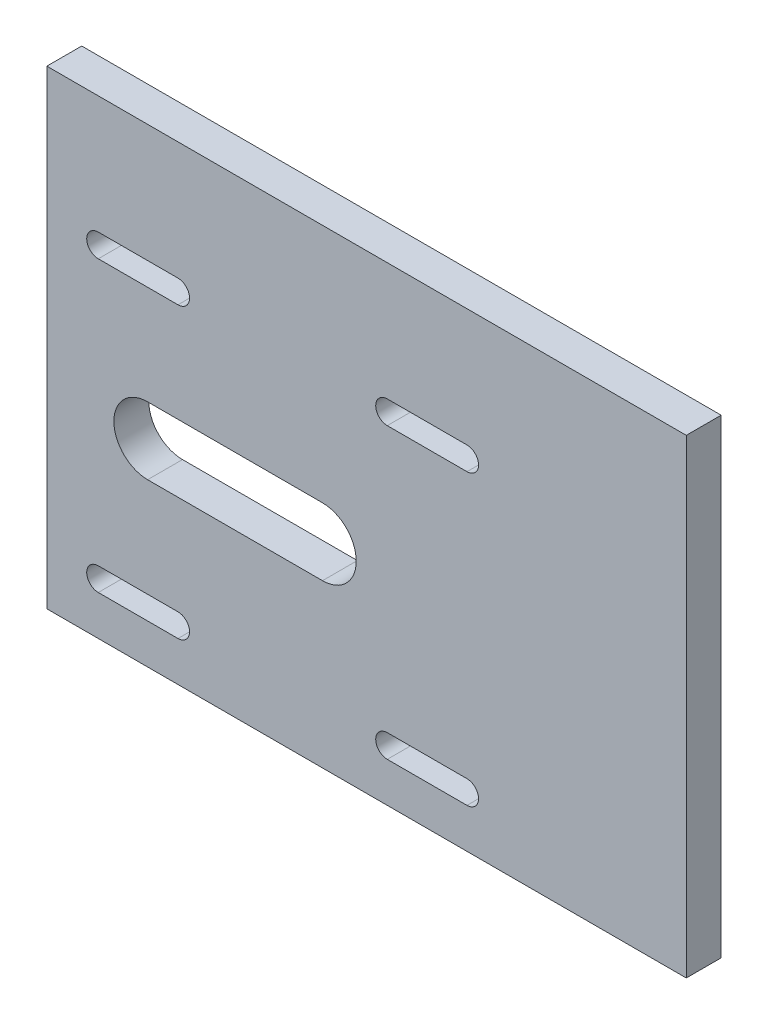
from build123d import *

# Parameters (mm, degrees)
SKETCH1_W           = 203.721686737
SKETCH1_H           = 149.733
BOSS_EXTRUDE1_DEPTH = 11.1125


with BuildPart() as part:
    # Sketch1 → Boss-Extrude1 (new body)
    with BuildSketch(Plane.XY):
        with Locations((-182.696343369, -43.420313263)):
            Rectangle(SKETCH1_W, SKETCH1_H)
        with BuildLine():
            Line((-242.774186737, -105.586813263), (-268.174186737, -105.586813263))
            ThreePointArc((-268.174186737, -105.586813263), (-271.857186737, -101.903813263), (-268.174186737, -98.220813263))
            Line((-268.174186737, -98.220813263), (-242.774186737, -98.220813263))
            ThreePointArc((-242.774186737, -98.220813263), (-239.091186737, -101.903813263), (-242.774186737, -105.586813263))
        make_face(mode=Mode.SUBTRACT)
        with BuildLine():
            Line((-242.774186737, -13.511813263), (-268.174186737, -13.511813263))
            ThreePointArc((-268.174186737, -13.511813263), (-271.857186737, -9.828813263), (-268.174186737, -6.145813263))
            Line((-268.174186737, -6.145813263), (-242.774186737, -6.145813263))
            ThreePointArc((-242.774186737, -6.145813263), (-239.091186737, -9.828813263), (-242.774186737, -13.511813263))
        make_face(mode=Mode.SUBTRACT)
        with BuildLine():
            Line((-150.699186737, -13.511813263), (-176.099186737, -13.511813263))
            ThreePointArc((-176.099186737, -13.511813263), (-179.782186737, -9.828813263), (-176.099186737, -6.145813263))
            Line((-176.099186737, -6.145813263), (-150.699186737, -6.145813263))
            ThreePointArc((-150.699186737, -6.145813263), (-147.016186737, -9.828813263), (-150.699186737, -13.511813263))
        make_face(mode=Mode.SUBTRACT)
        with BuildLine():
            Line((-150.699186737, -105.586813263), (-176.099186737, -105.586813263))
            ThreePointArc((-176.099186737, -105.586813263), (-179.782186737, -101.903813263), (-176.099186737, -98.220813263))
            Line((-176.099186737, -98.220813263), (-150.699186737, -98.220813263))
            ThreePointArc((-150.699186737, -98.220813263), (-147.016186737, -101.903813263), (-150.699186737, -105.586813263))
        make_face(mode=Mode.SUBTRACT)
        with BuildLine():
            Line((-196.736686737, -66.610669433), (-252.452295744, -66.610669433))
            ThreePointArc((-252.452295744, -66.610669433), (-263.196651914, -55.866313263), (-252.452295744, -45.121957093))
            Line((-252.452295744, -45.121957093), (-196.736686737, -45.121957093))
            ThreePointArc((-196.736686737, -45.121957093), (-185.992330568, -55.866313263), (-196.736686737, -66.610669433))
        make_face(mode=Mode.SUBTRACT)
    extrude(amount=BOSS_EXTRUDE1_DEPTH)


solid = part.part
